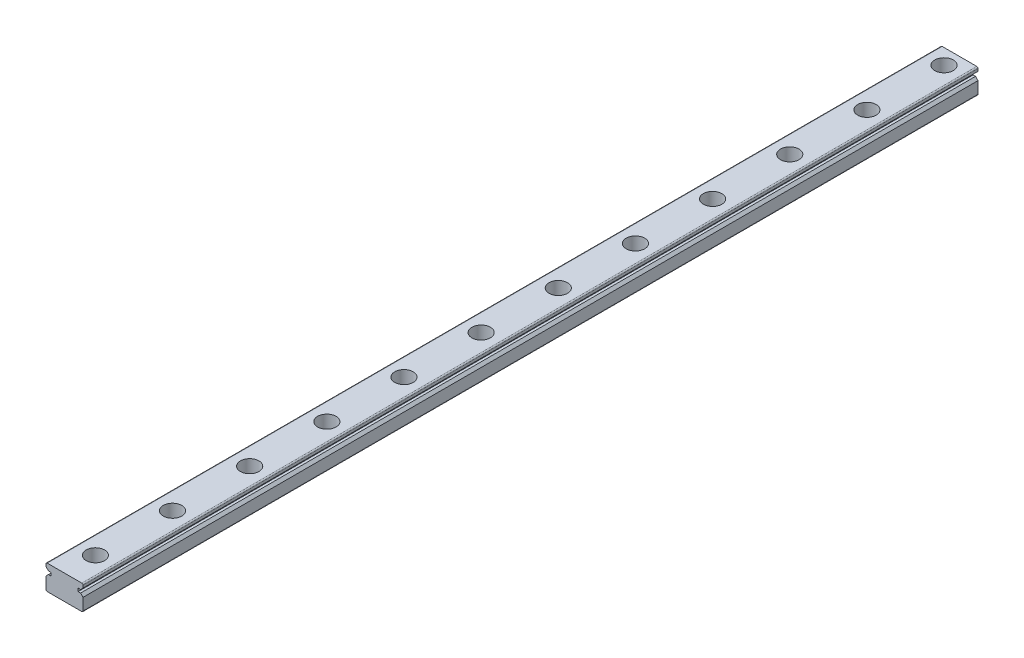
from build123d import *

# Parameters (mm, degrees)
BOSS_EXTRUDE1_DEPTH = 290
SKETCH2_R           = 3
CUT_EXTRUDE1_DEPTH  = 4.5
SKETCH3_R           = 1.75
CUT_EXTRUDE2_DEPTH  = 291.172362571


with BuildPart() as part:
    # Sketch1 → Boss-Extrude1 (new body)
    with BuildSketch(Plane.XY):
        with BuildLine():
            Line((-5.6, 4), (5.6, 4))
            ThreePointArc((5.6, 4), (5.882842712, 3.882842712), (6, 3.6))
            Line((6, 3.6), (6, 2.8))
            Line((6, 2.8), (5.2, 2))
            Line((5.2, 2), (4.4, 2))
            Line((4.4, 2), (4.4, 1))
            Line((4.4, 1), (5.2, 1))
            Line((5.2, 1), (6, 0.2))
            Line((6, 0.2), (6, -3.6))
            ThreePointArc((6, -3.6), (5.882842712, -3.882842712), (5.6, -4))
            Line((5.6, -4), (-5.6, -4))
            ThreePointArc((-5.6, -4), (-5.882842712, -3.882842712), (-6, -3.6))
            Line((-6, -3.6), (-6, 0.2))
            Line((-6, 0.2), (-5.2, 1))
            Line((-5.2, 1), (-4.4, 1))
            Line((-4.4, 1), (-4.4, 2))
            Line((-4.4, 2), (-5.2, 2))
            Line((-5.2, 2), (-6, 2.8))
            Line((-6, 2.8), (-6, 3.6))
            ThreePointArc((-6, 3.6), (-5.882842712, 3.882842712), (-5.6, 4))
        make_face()
    extrude(amount=BOSS_EXTRUDE1_DEPTH)

    # Sketch2 → Cut-Extrude1 (cut)
    with BuildSketch(Plane(origin=(0, 4, 0), x_dir=(1, 0, 0), z_dir=(0, 1, 0))):
        with Locations(Location((0, -280, 0), (0, 0, 270))):
            Circle(SKETCH2_R)
        with Locations(Location((0, -255, 0), (0, 0, 270))):
            Circle(SKETCH2_R)
        with Locations(Location((0, -230, 0), (0, 0, 270))):
            Circle(SKETCH2_R)
        with Locations(Location((0, -205, 0), (0, 0, 270))):
            Circle(SKETCH2_R)
        with Locations(Location((0, -180, 0), (0, 0, 270))):
            Circle(SKETCH2_R)
        with Locations(Location((0, -155, 0), (0, 0, 270))):
            Circle(SKETCH2_R)
        with Locations(Location((0, -130, 0), (0, 0, 270))):
            Circle(SKETCH2_R)
        with Locations(Location((0, -105, 0), (0, 0, 270))):
            Circle(SKETCH2_R)
        with Locations(Location((0, -80, 0), (0, 0, 270))):
            Circle(SKETCH2_R)
        with Locations(Location((0, -55, 0), (0, 0, 270))):
            Circle(SKETCH2_R)
        with Locations(Location((0, -30, 0), (0, 0, 270))):
            Circle(SKETCH2_R)
        with Locations(Location((0, -5, 0), (0, 0, 270))):
            Circle(SKETCH2_R)
        with Locations((0, 20)):
            Circle(SKETCH2_R)
        with Locations((0, 45)):
            Circle(SKETCH2_R)
        with Locations((0, 70)):
            Circle(SKETCH2_R)
        with Locations((0, 95)):
            Circle(SKETCH2_R)
        with Locations((0, 120)):
            Circle(SKETCH2_R)
        with Locations((0, 145)):
            Circle(SKETCH2_R)
    extrude(amount=-CUT_EXTRUDE1_DEPTH, mode=Mode.SUBTRACT)

    # Sketch3 → Cut-Extrude2 (cut, through all)
    with BuildSketch(Plane(origin=(0, 4, 0), x_dir=(1, 0, 0), z_dir=(0, 1, 0))):
        with Locations(Location((0, -280.001504258, 0), (0, 0, 270))):
            Circle(SKETCH3_R)
        with Locations(Location((0, -255.001504258, 0), (0, 0, 270))):
            Circle(SKETCH3_R)
        with Locations(Location((0, -230.001504258, 0), (0, 0, 270))):
            Circle(SKETCH3_R)
        with Locations(Location((0, -205.001504258, 0), (0, 0, 270))):
            Circle(SKETCH3_R)
        with Locations(Location((0, -180.001504258, 0), (0, 0, 270))):
            Circle(SKETCH3_R)
        with Locations(Location((0, -155.001504258, 0), (0, 0, 270))):
            Circle(SKETCH3_R)
        with Locations(Location((0, -130.001504258, 0), (0, 0, 270))):
            Circle(SKETCH3_R)
        with Locations(Location((0, -105.001504258, 0), (0, 0, 270))):
            Circle(SKETCH3_R)
        with Locations(Location((0, -80.001504258, 0), (0, 0, 270))):
            Circle(SKETCH3_R)
        with Locations(Location((0, -55.001504258, 0), (0, 0, 270))):
            Circle(SKETCH3_R)
        with Locations(Location((0, -30.001504258, 0), (0, 0, 270))):
            Circle(SKETCH3_R)
        with Locations(Location((0, -5.001504258, 0), (0, 0, 270))):
            Circle(SKETCH3_R)
        with Locations((0, 19.998495742)):
            Circle(SKETCH3_R)
        with Locations((0, 44.998495742)):
            Circle(SKETCH3_R)
        with Locations((0, 69.998495742)):
            Circle(SKETCH3_R)
    extrude(amount=-CUT_EXTRUDE2_DEPTH, mode=Mode.SUBTRACT)


solid = part.part
